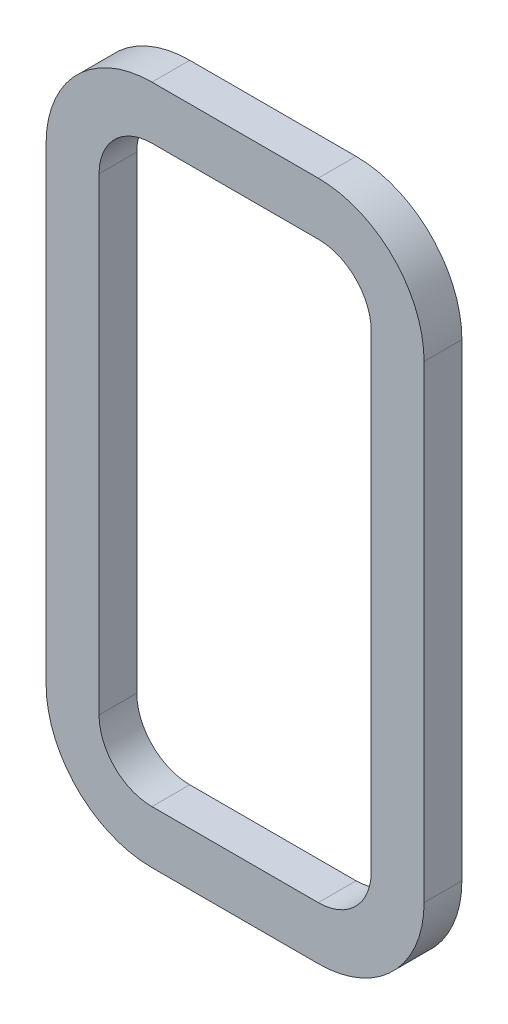
from build123d import *

# Parameters (mm, degrees)
SKETCH_1_W      = 100
SKETCH_1_H      = 180
SKETCH_1_W_2    = 72
SKETCH_1_H_2    = 152
EXTRUDE_1_DEPTH = 10
FILLET_1_R      = 14
FILLET_2_R      = 28


with BuildPart() as part:
    # 草图1 → 凸台-拉伸1 (new body)
    with BuildSketch(Plane.XY):
        Rectangle(SKETCH_1_W, SKETCH_1_H)
        Rectangle(SKETCH_1_W_2, SKETCH_1_H_2, mode=Mode.SUBTRACT)
    extrude(amount=EXTRUDE_1_DEPTH)

    # 圆角1
    fillet_1_edges = [part.edges().sort_by_distance(p)[0] for p in [
        (-36, 76, 5),
        (-36, -76, 5),
        (36, -76, 5),
        (36, 76, 5),
    ]]
    fillet(fillet_1_edges, radius=FILLET_1_R)

    # 圆角2
    fillet_2_edges = [part.edges().sort_by_distance(p)[0] for p in [
        (-50, 90, 5),
        (50, 90, 5),
        (50, -90, 5),
        (-50, -90, 5),
    ]]
    fillet(fillet_2_edges, radius=FILLET_2_R)


solid = part.part
